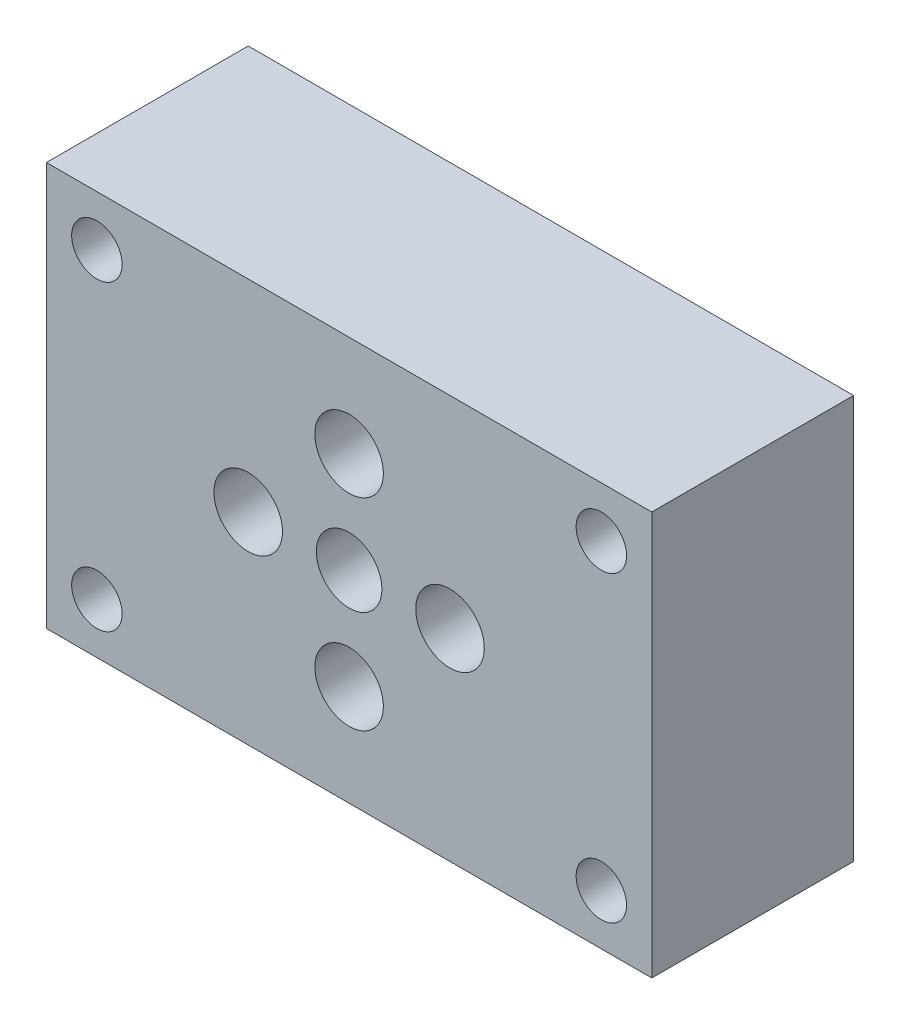
from build123d import *

# Parameters (mm, degrees)
SKETCH1_W           = 76.2
SKETCH1_H           = 50.8
SKETCH1_R           = 4.31365531
BOSS_EXTRUDE2_DEPTH = 25.4
SKETCH6_R           = 4.1275
SKETCH6_R_2         = 3.175
CUT_EXTRUDE3_DEPTH  = 25.4


with BuildPart() as part:
    # Sketch1 → Boss-Extrude2 (new body)
    with BuildSketch(Plane.XY):
        with Locations((38.1, 25.4)):
            Rectangle(SKETCH1_W, SKETCH1_H)
        with Locations((38.1, 38.1)):
            Circle(SKETCH1_R, mode=Mode.SUBTRACT)
        with Locations((50.8, 25.4)):
            Circle(SKETCH1_R, mode=Mode.SUBTRACT)
        with Locations((38.1, 12.7)):
            Circle(SKETCH1_R, mode=Mode.SUBTRACT)
        with Locations((25.4, 25.4)):
            Circle(SKETCH1_R, mode=Mode.SUBTRACT)
    extrude(amount=BOSS_EXTRUDE2_DEPTH)

    # Sketch6 → Cut-Extrude3 (cut)
    with BuildSketch(Plane.XY.offset(25.4)):
        with Locations((38.1, 25.4)):
            Circle(SKETCH6_R)
        with Locations((6.35, 44.45)):
            Circle(SKETCH6_R_2)
        with Locations((69.85, 44.45)):
            Circle(SKETCH6_R_2)
        with Locations((6.35, 6.35)):
            Circle(SKETCH6_R_2)
        with Locations((69.85, 6.35)):
            Circle(SKETCH6_R_2)
    extrude(amount=-CUT_EXTRUDE3_DEPTH, mode=Mode.SUBTRACT)


solid = part.part
